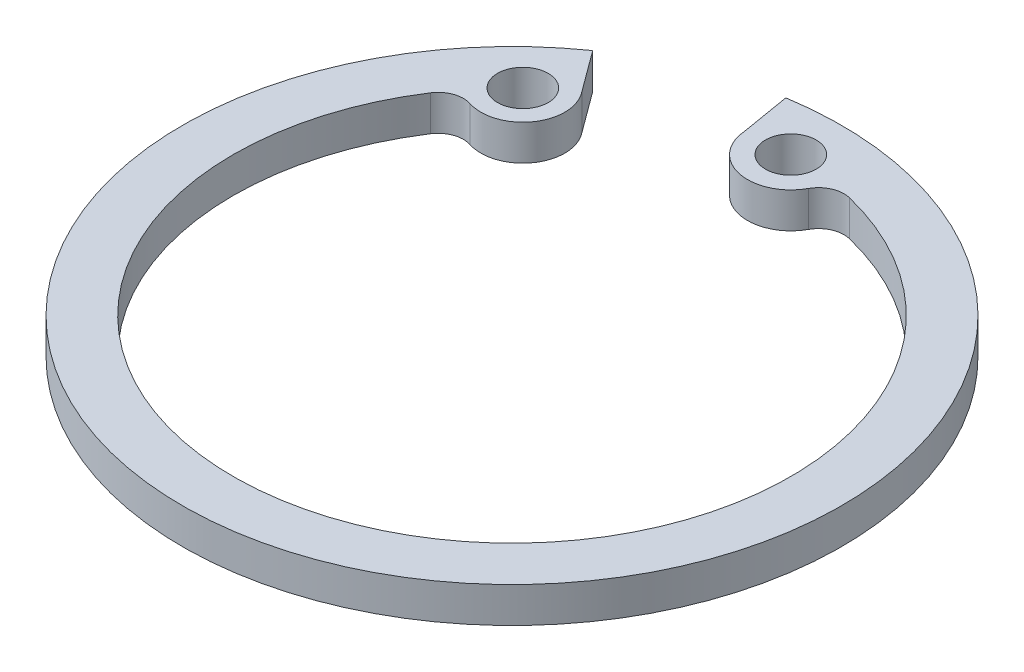
from build123d import *

# Parameters (mm, degrees)
SKETCH_1_R      = 1
EXTRUDE_1_DEPTH = 1.4


with BuildPart() as part:
    # 草图1 → 拉伸1 (new body)
    with BuildSketch(Plane(origin=(0, 0, 0), x_dir=(1, 0, 0), z_dir=(0, 1, 0))):
        with BuildLine():
            Line((-1.704686201, 10.867108399), (-2.036847592, 12.839441261))
            ThreePointArc((-2.036847592, 12.839441261), (4.873981347, -12.051734557), (-7.461076693, 10.64576604))
            Line((-7.461076693, 10.64576604), (-6.275343529, 9.034382303))
            ThreePointArc((-6.275343529, 9.034382303), (-6.193868184, 7.053393202), (-8.070099598, 6.412525252))
            ThreePointArc((-8.070099598, 6.412525252), (-8.711183181, 6.403482512), (-9.215009926, 6.006961967))
            ThreePointArc((-9.215009926, 6.006961967), (4.041226825, -10.230761739), (2.62241687, 10.682833414))
            ThreePointArc((2.62241687, 10.682833414), (1.978707932, 10.625847197), (1.504258862, 10.187091336))
            ThreePointArc((1.504258862, 10.187091336), (-0.354469436, 9.32728764), (-1.704686201, 10.867108399))
        make_face()
        with Locations(Location((0, 11, 0), (0, 0, 270))):
            Circle(SKETCH_1_R, mode=Mode.SUBTRACT)
        with Locations(Location((-7.561124809, 7.98932986, 0), (0, 0, 270))):
            Circle(SKETCH_1_R, mode=Mode.SUBTRACT)
    extrude(amount=EXTRUDE_1_DEPTH)


solid = part.part
